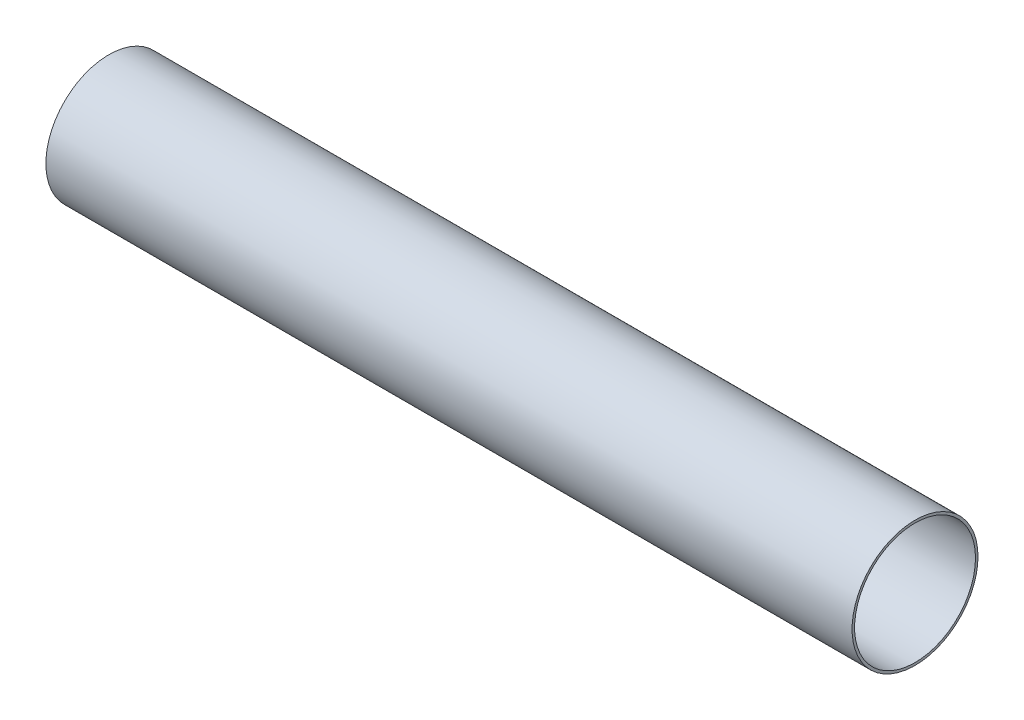
from build123d import *

# Parameters (mm, degrees)
SKETCH1_R           = 39.6748
SKETCH1_R_2         = 38.1
BOSS_EXTRUDE1_DEPTH = 508


with BuildPart() as part:
    # Sketch1 → Boss-Extrude1 (new body)
    with BuildSketch(Plane(origin=(0, 0, 0), x_dir=(0, 0, -1), z_dir=(1, 0, 0))):
        Circle(SKETCH1_R)
        Circle(SKETCH1_R_2, mode=Mode.SUBTRACT)
    extrude(amount=BOSS_EXTRUDE1_DEPTH)


solid = part.part
